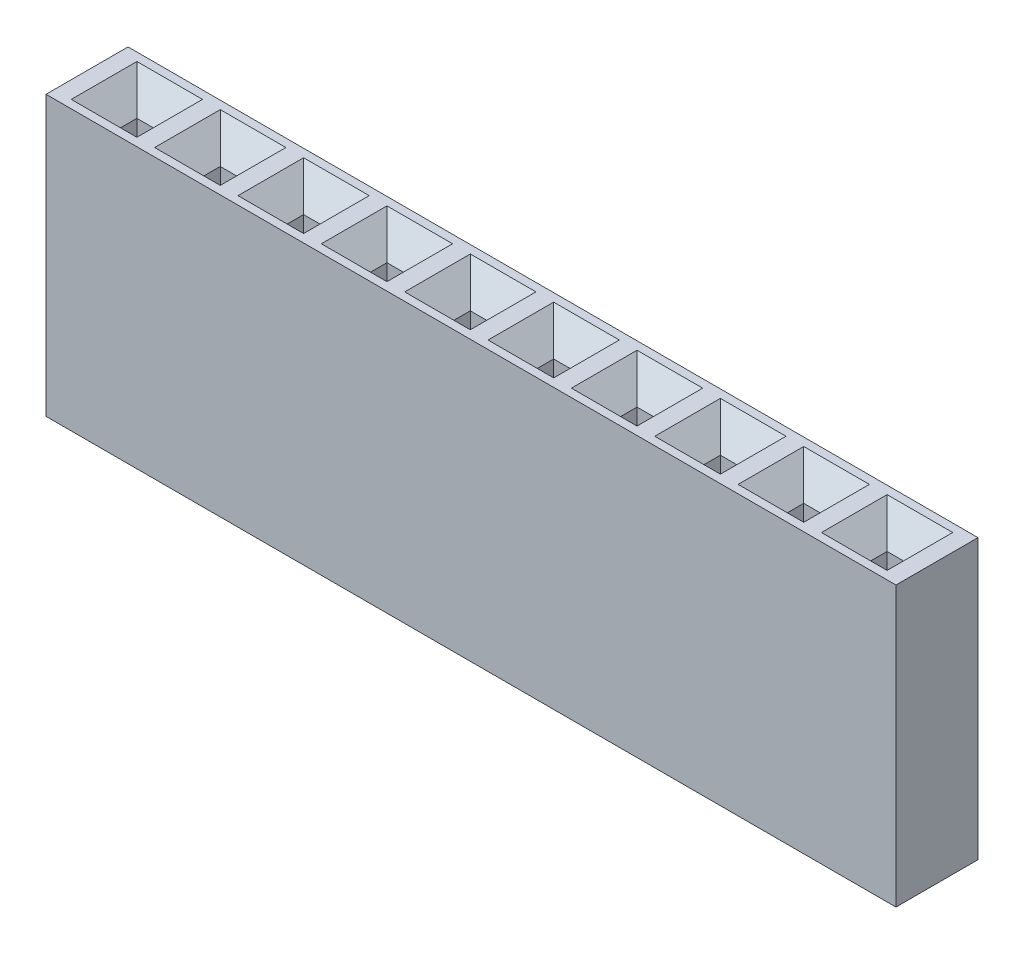
from build123d import *

# Parameters (mm, degrees)
SKETCH_1_W                         = 25.9
SKETCH_1_H                         = 2.5
EXTRUDE_1_DEPTH                    = 8.5
SKETCH_2_W                         = 0.5
SKETCH_2_H                         = 0.5
CUT_EXTRUDE_1_DEPTH                = 7.5
CHAMFER_1_SIZE                     = 0.75
SKETCH_6_W                         = 0.5
SKETCH_6_H                         = 0.5
CUT_EXTRUDE_3_DEPTH                = 7.5
CHAMFER_3_SIZE                     = 0.75
PATTERN_LINEAR_1_COUNT             = 5
PATTERN_LINEAR_1_PITCH             = 2.54
CHAMFER_3_OF_PATTERN_LINEAR_1_SIZE = 0.75
PATTERN_LINEAR_2_COUNT             = 5
PATTERN_LINEAR_2_PITCH             = 2.54
CHAMFER_1_OF_PATTERN_LINEAR_2_SIZE = 0.75


with BuildPart() as part:
    # Эскиз1 → Бобышка-Вытянуть1 (new body)
    with BuildSketch(Plane(origin=(0, 0, 0), x_dir=(1, 0, 0), z_dir=(0, 1, 0))):
        Rectangle(SKETCH_1_W, SKETCH_1_H)
    extrude(amount=EXTRUDE_1_DEPTH)

    # Эскиз2 → Вырез-Вытянуть1 (cut)
    with BuildSketch(Plane(origin=(0, 8.5, 0), x_dir=(1, 0, 0), z_dir=(0, 1, 0))):
        with Locations((1.27, 0)):
            Rectangle(SKETCH_2_W, SKETCH_2_H)
    cut_extrude_1 = extrude(amount=-CUT_EXTRUDE_1_DEPTH, mode=Mode.SUBTRACT)

    # Фаска1
    chamfer_1_edges = [part.edges().sort_by_distance(p)[0] for p in [
        (1.52, 8.5, 0),
        (1.27, 8.5, -0.25),
        (1.02, 8.5, 0),
        (1.27, 8.5, 0.25),
    ]]
    chamfer(chamfer_1_edges, length=CHAMFER_1_SIZE)

    # Эскиз6 → Вырез-Вытянуть3 (cut)
    with BuildSketch(Plane(origin=(0, 8.5, 0), x_dir=(1, 0, 0), z_dir=(0, 1, 0))):
        with Locations((-1.27, 0)):
            Rectangle(SKETCH_6_W, SKETCH_6_H)
    cut_extrude_3 = extrude(amount=-CUT_EXTRUDE_3_DEPTH, mode=Mode.SUBTRACT)

    # Фаска3
    chamfer_3_edges = [part.edges().sort_by_distance(p)[0] for p in [
        (-1.02, 8.5, 0),
        (-1.27, 8.5, -0.25),
        (-1.52, 8.5, 0),
        (-1.27, 8.5, 0.25),
    ]]
    chamfer(chamfer_3_edges, length=CHAMFER_3_SIZE)

    # Линейный массив1: Вырез-Вытянуть3 ×5
    with Locations(*[(-i * PATTERN_LINEAR_1_PITCH, 0, 0) for i in range(1, PATTERN_LINEAR_1_COUNT)]):
        add(cut_extrude_3, mode=Mode.SUBTRACT)

    # Фаска3 of Линейный массив1
    chamfer_3_of_pattern_linear_1_edges = [part.edges().sort_by_distance(p)[0] for p in [
        (-3.56, 8.5, 0),
        (-3.81, 8.5, -0.25),
        (-4.06, 8.5, 0),
        (-3.81, 8.5, 0.25),
        (-6.1, 8.5, 0),
        (-6.35, 8.5, -0.25),
        (-6.6, 8.5, 0),
        (-6.35, 8.5, 0.25),
        (-8.64, 8.5, 0),
        (-8.89, 8.5, -0.25),
        (-9.14, 8.5, 0),
        (-8.89, 8.5, 0.25),
        (-11.18, 8.5, 0),
        (-11.43, 8.5, -0.25),
        (-11.68, 8.5, 0),
        (-11.43, 8.5, 0.25),
    ]]
    chamfer(chamfer_3_of_pattern_linear_1_edges, length=CHAMFER_3_OF_PATTERN_LINEAR_1_SIZE)

    # Линейный массив2: Вырез-Вытянуть1 ×5
    with Locations(*[(i * PATTERN_LINEAR_2_PITCH, 0, 0) for i in range(1, PATTERN_LINEAR_2_COUNT)]):
        add(cut_extrude_1, mode=Mode.SUBTRACT)

    # Фаска1 of Линейный массив2
    chamfer_1_of_pattern_linear_2_edges = [part.edges().sort_by_distance(p)[0] for p in [
        (4.06, 8.5, 0),
        (3.81, 8.5, -0.25),
        (3.56, 8.5, 0),
        (3.81, 8.5, 0.25),
        (6.6, 8.5, 0),
        (6.35, 8.5, -0.25),
        (6.1, 8.5, 0),
        (6.35, 8.5, 0.25),
        (9.14, 8.5, 0),
        (8.89, 8.5, -0.25),
        (8.64, 8.5, 0),
        (8.89, 8.5, 0.25),
        (11.68, 8.5, 0),
        (11.43, 8.5, -0.25),
        (11.18, 8.5, 0),
        (11.43, 8.5, 0.25),
    ]]
    chamfer(chamfer_1_of_pattern_linear_2_edges, length=CHAMFER_1_OF_PATTERN_LINEAR_2_SIZE)


solid = part.part
